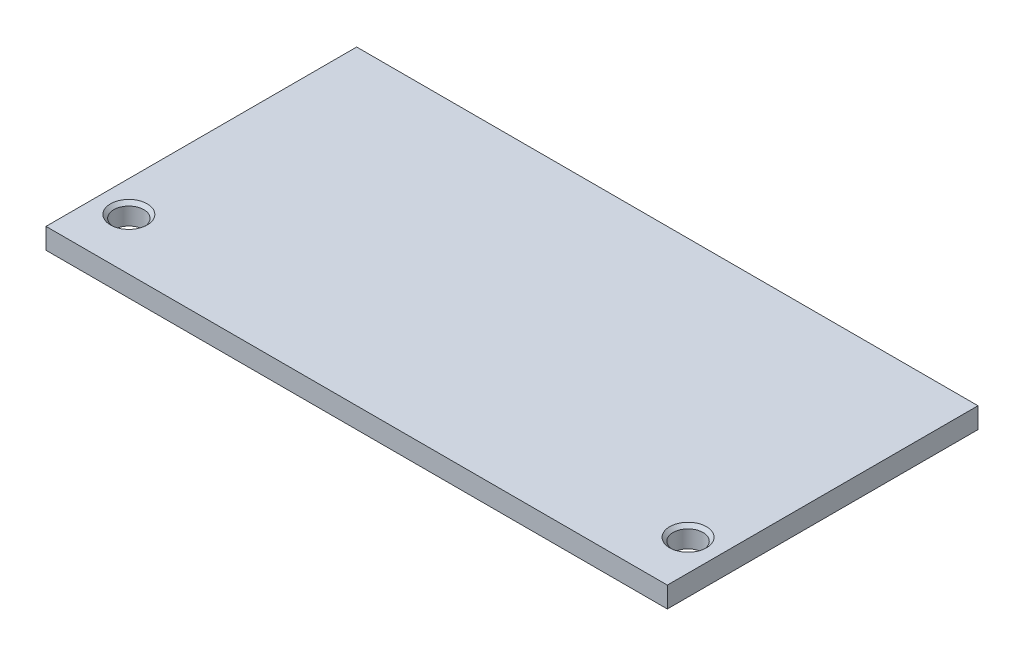
from build123d import *

# Parameters (mm, degrees)
SKETCH_1_W                     = 60
SKETCH_1_H                     = 30
EXTRUDE_1_DEPTH                = 2
HOLE_WIZARD_M3_5_1_D           = 2.9
HOLE_WIZARD_M3_5_1_CSINK_D     = 3.55
HOLE_WIZARD_M3_5_1_CSINK_ANGLE = 90


with BuildPart() as part:
    # 草图1 → 凸台-拉伸1 (new body)
    with BuildSketch(Plane(origin=(0, 0, 0), x_dir=(1, 0, 0), z_dir=(0, 1, 0))):
        with Locations((30, 15)):
            Rectangle(SKETCH_1_W, SKETCH_1_H)
    extrude(amount=EXTRUDE_1_DEPTH)

    # M3.5 螺纹孔1 (through all)
    with Locations(Plane(origin=(0, 2, 0), x_dir=(1, 0, 0), z_dir=(0, 1, 0))):
        with Locations((3, 5), (57, 5)):
            CounterSinkHole(HOLE_WIZARD_M3_5_1_D / 2, HOLE_WIZARD_M3_5_1_CSINK_D / 2, counter_sink_angle=HOLE_WIZARD_M3_5_1_CSINK_ANGLE)


solid = part.part
